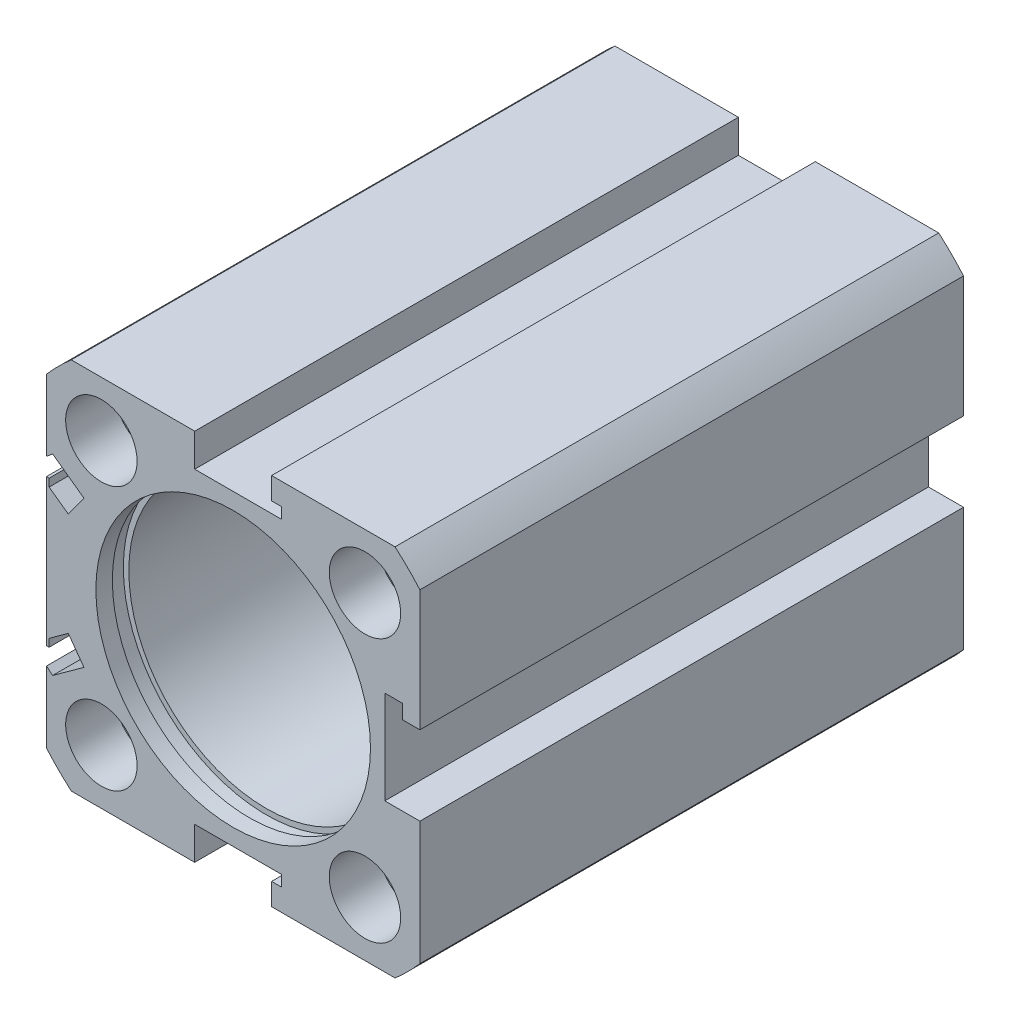
from build123d import *

# Parameters (mm, degrees)
SKETCH_1_R          = 12.5
SKETCH_1_R_2        = 2.1
EXTRUDE_1_DEPTH     = 49.5
SKETCH_2_R          = 3.25
CUT_EXTRUDE_2_DEPTH = 4.5
SKETCH_4_W          = 13
SKETCH_4_H          = 1.5
SKETCH_5_R          = 2.1
CUT_EXTRUDE_3_DEPTH = 4


with BuildPart() as part:
    # 草图1 → 拉伸1 (new body)
    with BuildSketch(Plane.XY):
        with BuildLine():
            Line((-17, 8.268803112), (-16.434277079, 8.730182715))
            Line((-16.434277079, 8.730182715), (-13.585223978, 6.669165578))
            Line((-13.585223978, 6.669165578), (-15.009750528, 4.699967111))
            Line((-15.009750528, 4.699967111), (-16.756503192, 5.963575421))
            Line((-16.756503192, 5.963575421), (-16.756503192, 6.669165578))
            Line((-16.756503192, 6.669165578), (-17, 6.669165578))
            Line((-17, 6.669165578), (-17, -6.669165578))
            Line((-17, -6.669165578), (-16.756503192, -6.669165578))
            Line((-16.756503192, -6.669165578), (-16.756503192, -5.963575421))
            Line((-16.756503192, -5.963575421), (-15.009750528, -4.699967111))
            Line((-15.009750528, -4.699967111), (-13.585223978, -6.669165578))
            Line((-13.585223978, -6.669165578), (-16.434277079, -8.730182715))
            Line((-16.434277079, -8.730182715), (-17, -8.268803112))
            Line((-17, -8.268803112), (-17, -14.739402973))
            ThreePointArc((-17, -14.739402973), (-15.909902577, -15.909902577), (-14.739402973, -17))
            Line((-14.739402973, -17), (-3.5, -17))
            Line((-3.5, -17), (-3.5, -14))
            Line((-3.5, -14), (4.42289808, -14))
            Line((4.42289808, -14), (4.42289808, -15))
            Line((4.42289808, -15), (3.5, -15))
            Line((3.5, -15), (3.5, -17))
            Line((3.5, -17), (14.739402973, -17))
            ThreePointArc((14.739402973, -17), (15.909902577, -15.909902577), (17, -14.739402973))
            Line((17, -14.739402973), (17, -3.5))
            Line((17, -3.5), (13.805038875, -3.5))
            Line((13.805038875, -3.5), (13.805038875, 5))
            Line((13.805038875, 5), (15.402519437, 5))
            Line((15.402519437, 5), (15.402519437, 3.7))
            Line((15.402519437, 3.7), (17, 3.7))
            Line((17, 3.7), (17, 14.739402973))
            ThreePointArc((17, 14.739402973), (15.909902577, 15.909902577), (14.739402973, 17))
            Line((14.739402973, 17), (3.5, 17))
            Line((3.5, 17), (3.5, 15))
            Line((3.5, 15), (4.42289808, 15))
            Line((4.42289808, 15), (4.42289808, 14))
            Line((4.42289808, 14), (-3.5, 14))
            Line((-3.5, 14), (-3.5, 17))
            Line((-3.5, 17), (-14.739402973, 17))
            ThreePointArc((-14.739402973, 17), (-15.909902577, 15.909902577), (-17, 14.739402973))
            Line((-17, 14.739402973), (-17, 8.268803112))
        make_face()
        Circle(SKETCH_1_R, mode=Mode.SUBTRACT)
        with Locations((12, 12)):
            Circle(SKETCH_1_R_2, mode=Mode.SUBTRACT)
        with Locations((-12, 12)):
            Circle(SKETCH_1_R_2, mode=Mode.SUBTRACT)
        with Locations((-12, -12)):
            Circle(SKETCH_1_R_2, mode=Mode.SUBTRACT)
        with Locations((12, -12)):
            Circle(SKETCH_1_R_2, mode=Mode.SUBTRACT)
    extrude(amount=EXTRUDE_1_DEPTH)

    # 草图2 → 拉伸2 (cut)
    with BuildSketch(Plane.XY.offset(49.5)):
        with Locations((-12, 12)):
            Circle(SKETCH_2_R)
        with Locations((12, 12)):
            Circle(SKETCH_2_R)
        with Locations((12, -12)):
            Circle(SKETCH_2_R)
        with Locations((-12, -12)):
            Circle(SKETCH_2_R)
    cut_extrude_2 = extrude(amount=-CUT_EXTRUDE_2_DEPTH, mode=Mode.SUBTRACT)

    # 草图4 → 切除-旋转1 (revolve, cut)
    with BuildSketch(Plane(origin=(0, 0, 0), x_dir=(1, 0, 0), z_dir=(0, 1, 0)), mode=Mode.PRIVATE) as cut_revolve_1_sk:
        with Locations((6.5, -2.25)):
            Rectangle(SKETCH_4_W, SKETCH_4_H)
        with Locations((6.5, -47.25)):
            Rectangle(SKETCH_4_W, SKETCH_4_H)
    revolve(cut_revolve_1_sk.sketch.rotate(Axis((0, 0, 0), (0, 0, 1)), 180), axis=Axis((0, 0, 0), (0, 0, 1)), mode=Mode.SUBTRACT)

    # 镜向1: 拉伸2 across plane
    add(cut_extrude_2.mirror(Plane.XY.offset(24.75)), mode=Mode.SUBTRACT)

    # 草图5 → 拉伸3 (cut)
    with BuildSketch(Plane.ZY.offset(17)):
        with Locations((7.25, 0)):
            Circle(SKETCH_5_R)
        with Locations((42.25, 0)):
            Circle(SKETCH_5_R)
    extrude(amount=-CUT_EXTRUDE_3_DEPTH, mode=Mode.SUBTRACT)


solid = part.part
